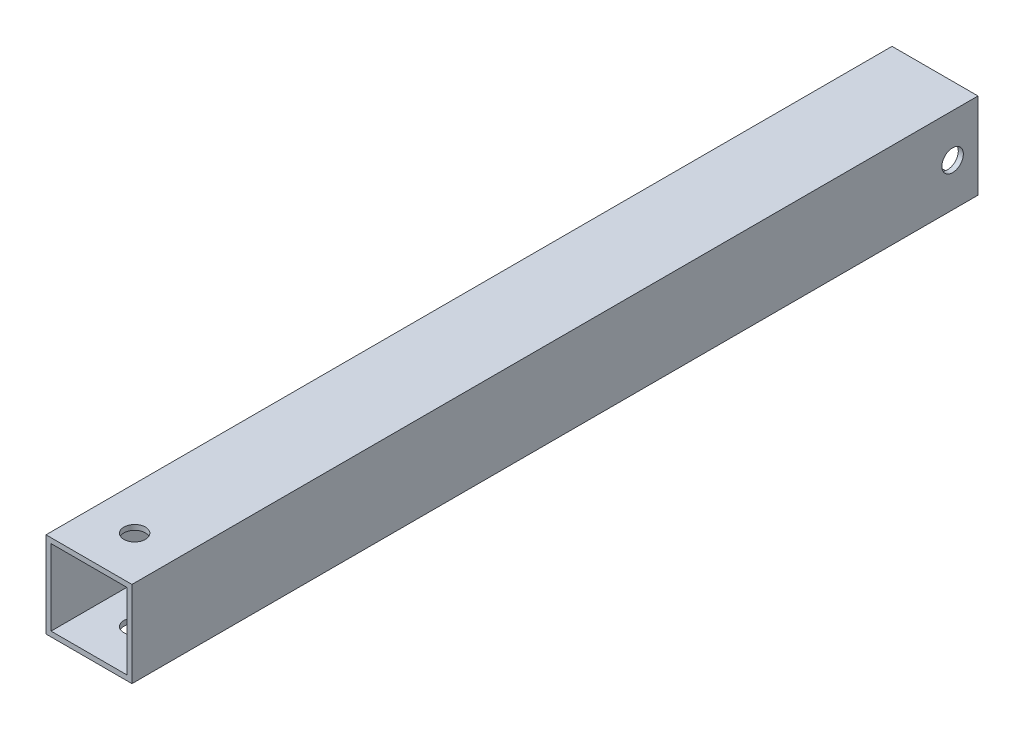
from build123d import *

# Parameters (mm, degrees)
CROQUIS1_W              = 50.8
CROQUIS1_H              = 50.8
CROQUIS1_W_2            = 44.8
CROQUIS1_H_2            = 44.8
SALIENTE_EXTRUIR1_DEPTH = 250
CROQUIS2_R              = 6.35
CORTAR_EXTRUIR1_DEPTH   = 257.370435113
CROQUIS3_R              = 6.35
CORTAR_EXTRUIR2_DEPTH   = 70


with BuildPart() as part:
    # Croquis1 → Saliente-Extruir1 (new, symmetric)
    with BuildSketch(Plane.XY):
        Rectangle(CROQUIS1_W, CROQUIS1_H)
        Rectangle(CROQUIS1_W_2, CROQUIS1_H_2, mode=Mode.SUBTRACT)
    extrude(amount=SALIENTE_EXTRUIR1_DEPTH, both=True)

    # Croquis2 → Cortar-Extruir1 (cut, through all)
    with BuildSketch(Plane(origin=(25.4, 0, 0), x_dir=(0, 0, -1), z_dir=(1, 0, 0))):
        with Locations(Location((235, 0, 0), (0, 0, 270))):
            Circle(CROQUIS2_R)
    extrude(amount=-CORTAR_EXTRUIR1_DEPTH, mode=Mode.SUBTRACT)

    # Croquis3 → Cortar-Extruir2 (cut)
    with BuildSketch(Plane(origin=(0, 25.4, 0), x_dir=(1, 0, 0), z_dir=(0, 1, 0))):
        with Locations(Location((0, -223, 0), (0, 0, 270))):
            Circle(CROQUIS3_R)
    extrude(amount=-CORTAR_EXTRUIR2_DEPTH, mode=Mode.SUBTRACT)


solid = part.part
